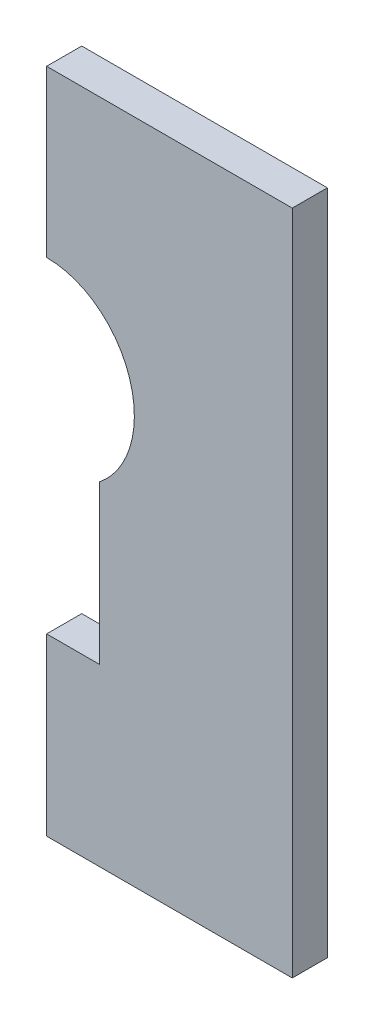
from build123d import *

# Parameters (mm, degrees)
ESQUISSE1_W             = 70
ESQUISSE1_H             = 190
BOSS_EXTRU_1_DEPTH      = 10
ENL_V_MAT_EXTRU_1_DEPTH = 203.731349327
ESQUISSE3_W             = 15
ESQUISSE3_H             = 45
ENL_V_MAT_EXTRU_2_DEPTH = 203.731349327


with BuildPart() as part:
    # Esquisse1 → Boss.-Extru.1 (new body)
    with BuildSketch(Plane.XY):
        with Locations((35, 95)):
            Rectangle(ESQUISSE1_W, ESQUISSE1_H)
    extrude(amount=BOSS_EXTRU_1_DEPTH)

    # Esquisse2 → Enlèv. mat.-Extru.1 (cut, through all)
    with BuildSketch(Plane(origin=(0, 0, 0), x_dir=(1, 0, 0), z_dir=(0, -0.34202014332566943, -0.9396926207859081))):
        with BuildLine():
            Line((0, -80.778483455), (0, -130.778483455))
            ThreePointArc((0, -130.778483455), (25, -105.778483455), (0, -80.778483455))
        make_face()
    extrude(amount=-ENL_V_MAT_EXTRU_1_DEPTH, mode=Mode.SUBTRACT)

    # Esquisse3 → Enlèv. mat.-Extru.2 (cut, through all)
    with BuildSketch(Plane(origin=(0, 0, 0), x_dir=(-1, 0, 0), z_dir=(0, 0, -1))):
        with Locations((-7.5, 72.423257792)):
            Rectangle(ESQUISSE3_W, ESQUISSE3_H)
    extrude(amount=-ENL_V_MAT_EXTRU_2_DEPTH, mode=Mode.SUBTRACT)


solid = part.part
